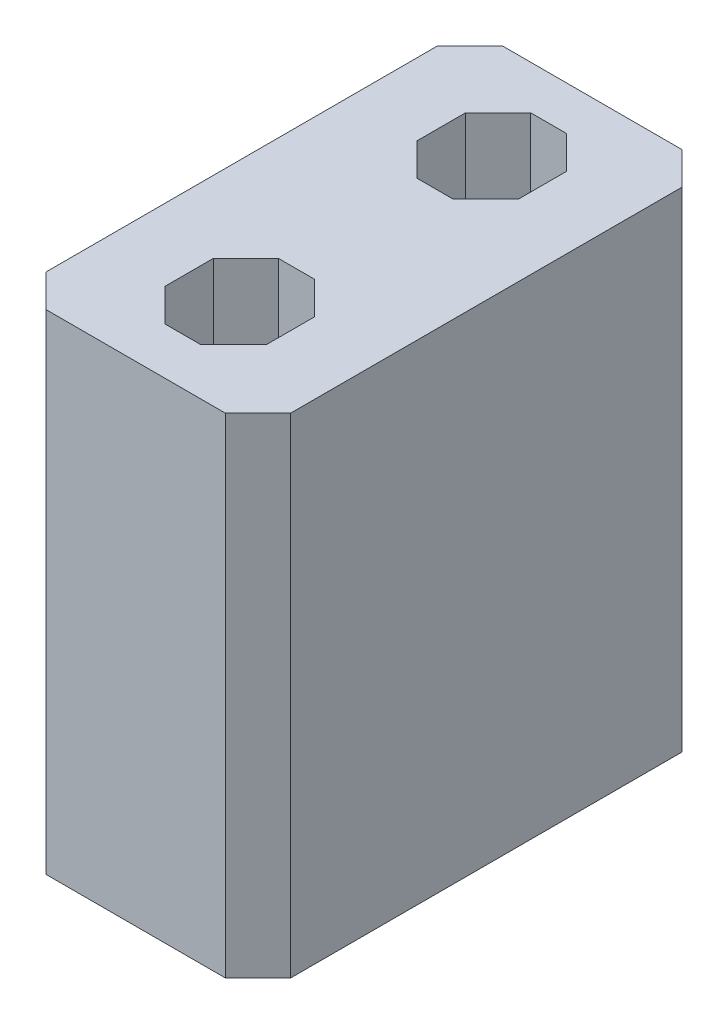
from build123d import *

# Parameters (mm, degrees)
SKETCH1_W           = 15
SKETCH1_H           = 28
SKETCH1_R           = 4
BOSS_EXTRUDE1_DEPTH = 10
SKETCH2_W           = 15
SKETCH2_H           = 28
BOSS_EXTRUDE2_DEPTH = 20
CUT_EXTRUDE1_DEPTH  = 15
CHAMFER1_SIZE       = 2


with BuildPart() as part:
    # Sketch1 → Boss-Extrude1 (new body)
    with BuildSketch(Plane(origin=(0, 0, 0), x_dir=(1, 0, 0), z_dir=(0, 1, 0))):
        with Locations((-0.01385015, -0.098387905)):
            Rectangle(SKETCH1_W, SKETCH1_H)
        with Locations(Location((0, 8, 0), (0, 0, 270))):
            Circle(SKETCH1_R, mode=Mode.SUBTRACT)
        with Locations(Location((0, -8, 0), (0, 0, 90))):
            Circle(SKETCH1_R, mode=Mode.SUBTRACT)
    extrude(amount=BOSS_EXTRUDE1_DEPTH)

    # Sketch2 → Boss-Extrude2 (add)
    with BuildSketch(Plane(origin=(0, 10, 0), x_dir=(1, 0, 0), z_dir=(0, 1, 0))):
        with Locations((-0.01385015, -0.098387905)):
            Rectangle(SKETCH2_W, SKETCH2_H)
    extrude(amount=BOSS_EXTRUDE2_DEPTH)

    # Sketch3 → Cut-Extrude1 (cut)
    with BuildSketch(Plane(origin=(0, 30, 0), x_dir=(1, 0, 0), z_dir=(0, 1, 0))):
        Polygon((-3.103489636, 9.215029418), (-1.103489636, 11.215029418), (1.103489636, 11.215029418), (3.103489636, 9.215029418), (3.103489636, 6.25292645), (1.103489636, 4.25292645), (-1.103489636, 4.25292645), (-3.103489636, 6.25292645), align=None)
        Polygon((-1.103489636, -4.25292645), (1.103489636, -4.25292645), (3.103489636, -6.25292645), (3.103489636, -9.215029418), (1.103489636, -11.215029418), (-1.103489636, -11.215029418), (-3.103489636, -9.215029418), (-3.103489636, -6.25292645), align=None)
    extrude(amount=-CUT_EXTRUDE1_DEPTH, mode=Mode.SUBTRACT)

    # Chamfer1
    chamfer1_edges = [part.edges().sort_by_distance(p)[0] for p in [
        (7.48614985, 15, 14.098387905),
        (-7.51385015, 15, 14.098387905),
        (-7.51385015, 15, -13.901612095),
        (7.48614985, 15, -13.901612095),
    ]]
    chamfer(chamfer1_edges, length=CHAMFER1_SIZE)


solid = part.part
